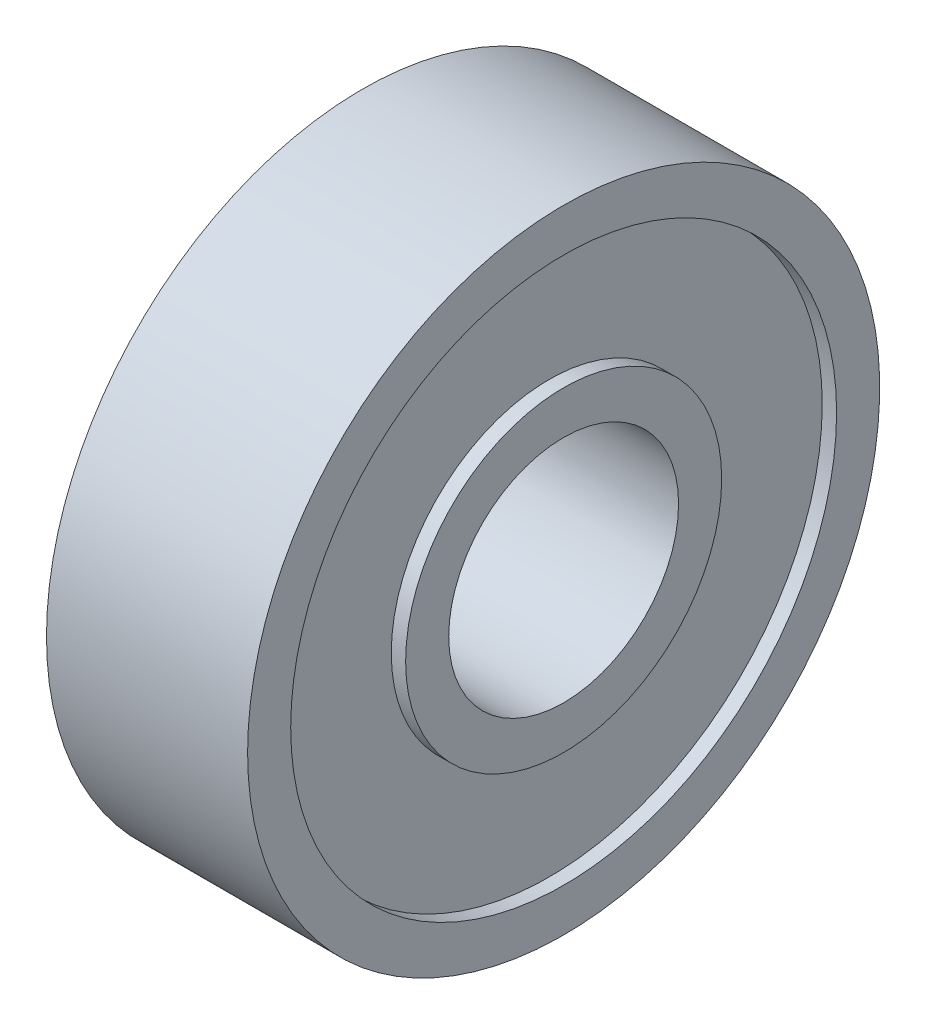
from build123d import *


with BuildPart() as part:
    # Croquis1 → Revolución1 (revolve)
    with BuildSketch(Plane.XY, mode=Mode.PRIVATE) as revoluci_n1_sk:
        Polygon((-3.5, 11), (3.5, 11), (3.5, 9.5), (3, 9.5), (3, 5.5), (3.5, 5.5), (3.5, 4), (-3.5, 4), (-3.5, 5.5), (-3, 5.5), (-3, 9.5), (-3.5, 9.5), align=None)
    revolve(revoluci_n1_sk.sketch.rotate(Axis((-3.5, 0, 0), (1, 0, 0)), 90), axis=Axis((-3.5, 0, 0), (1, 0, 0)))


solid = part.part
